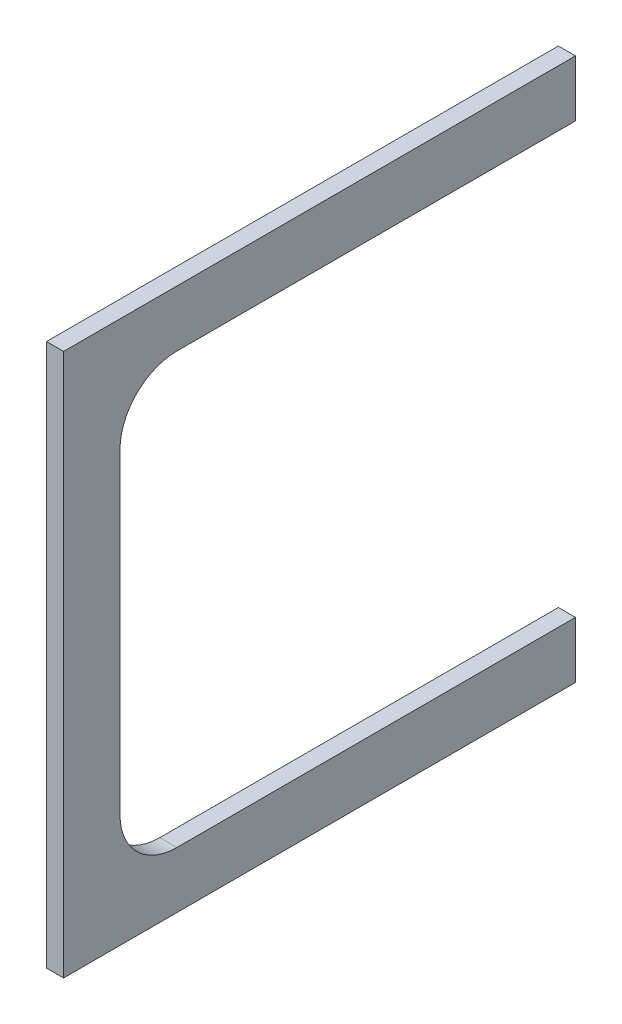
from build123d import *

# Parameters (mm, degrees)
EXTRUDE_1_DEPTH = 3


with BuildPart() as part:
    # Эскиз1 → Бобышка-Вытянуть1 (new body)
    with BuildSketch(Plane(origin=(-1.5, 0, 0), x_dir=(0, -1, 0), z_dir=(-1, 0, 0))):
        with BuildLine():
            Line((-237, -36.5), (-237, 33.5))
            ThreePointArc((-237, 33.5), (-234.071067812, 40.571067812), (-227, 43.5))
            Line((-227, 43.5), (-171.5, 43.5))
            ThreePointArc((-171.5, 43.5), (-164.428932188, 40.571067812), (-161.5, 33.5))
            Line((-161.5, 33.5), (-161.5, -36.5))
            Line((-161.5, -36.5), (-151.6, -36.5))
            Line((-151.6, -36.5), (-151.6, 53.4))
            Line((-151.6, 53.4), (-246.9, 53.4))
            Line((-246.9, 53.4), (-246.9, -36.5))
            Line((-246.9, -36.5), (-237, -36.5))
        make_face()
    extrude(amount=-EXTRUDE_1_DEPTH)


solid = part.part
